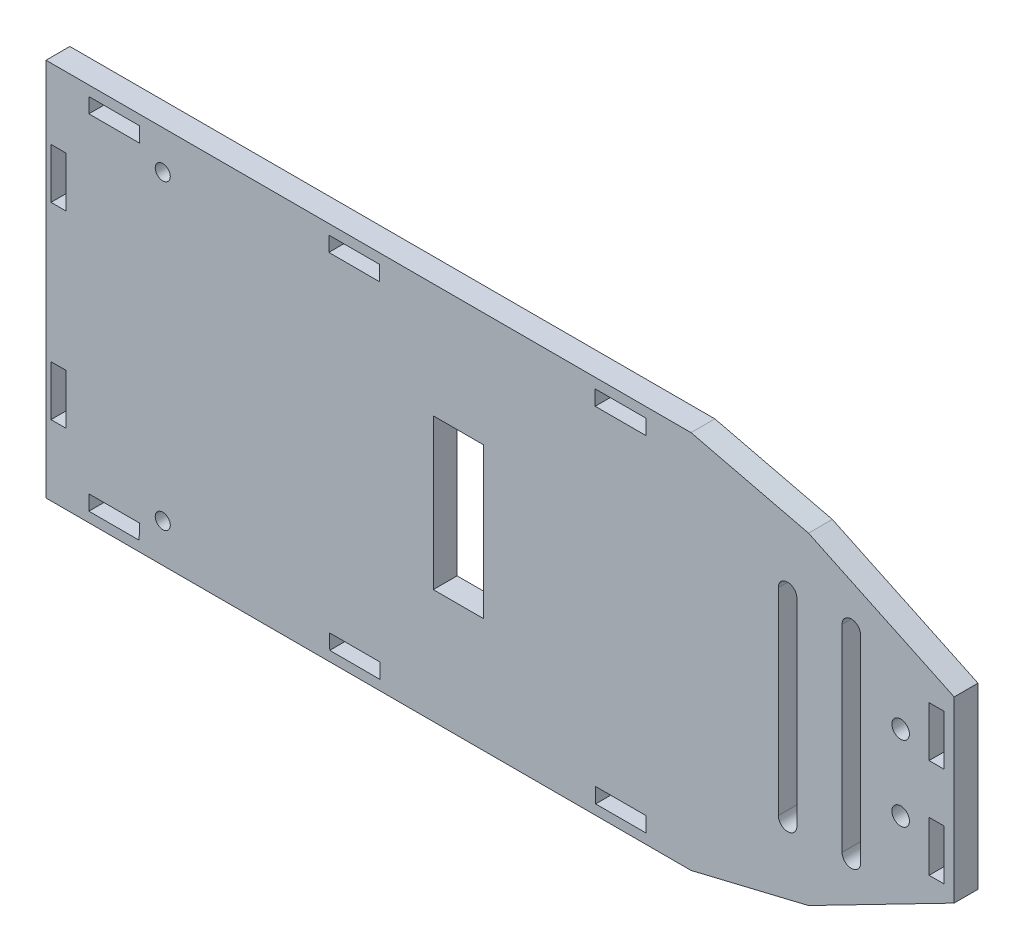
from build123d import *

# Parameters (mm, degrees)
SKETCH1_W           = 181
SKETCH1_H           = 75.57
BOSS_EXTRUDE2_DEPTH = 4.75
SKETCH6_W           = 3
SKETCH6_H           = 10
SKETCH6_W_2         = 10.095812656
SKETCH6_H_2         = 3.003442242
SKETCH6_W_3         = 10
SKETCH6_H_3         = 30
SKETCH6_R           = 1.5
SKETCH6_R_2         = 1.85
SKETCH6_R_3         = 1.75
CUT_EXTRUDE7_DEPTH  = 9
CUT_EXTRUDE8_DEPTH  = 4.75


with BuildPart() as part:
    # Sketch1 → Boss-Extrude2 (new body)
    with BuildSketch(Plane.XY):
        Rectangle(SKETCH1_W, SKETCH1_H)
    extrude(amount=BOSS_EXTRUDE2_DEPTH)

    # Sketch6 → Cut-Extrude7 (cut)
    with BuildSketch(Plane.XY.offset(4.75)):
        Polygon((-81.955185068, 35.785), (-81.955183992, 32.802018857), (-71.81277502, 32.798644215), (-71.859372412, 35.785), align=None)
        with Locations((-88, 18.75)):
            Rectangle(SKETCH6_W, SKETCH6_H)
        with Locations((-88, -18.75)):
            Rectangle(SKETCH6_W, SKETCH6_H)
        Polygon((-34.13878131, 35.785), (-34.130786214, 32.798291399), (-24.042968654, 32.781557758), (-24.042968654, 35.785), align=None)
        Polygon((-71.81277502, -32.788413815), (-81.955183992, -32.785039173), (-81.955181828, -35.785039173), (-71.955181828, -35.785031959), align=None)
        Polygon((-33.95518398, -32.801010013), (-33.947153334, -35.800999264), (-23.947156396, -35.808824865), (-23.946905936, -32.804340026), align=None)
        with Locations((87, 9.9)):
            Rectangle(SKETCH6_W, SKETCH6_H)
        with Locations((24.004937674, 34.283278879)):
            Rectangle(SKETCH6_W_2, SKETCH6_H_2)
        Polygon((29.052844002, -32.806257253), (19.053094123, -32.805423656), (19.052844037, -35.805423646), (29.052844002, -35.806257264), align=None)
        with Locations((-8.31156853, 0)):
            Rectangle(SKETCH6_W_3, SKETCH6_H_3)
        with Locations((87, -9.9)):
            Rectangle(SKETCH6_W, SKETCH6_H)
        Polygon((61.466273892, -32.14), (38.055212144, -37.785), (90.5, -37.785), (90.5, -17.2), align=None)
        Polygon((61.46627389, 32.14), (90.5, 18.385572572), (90.5, 37.785), (38.055212144, 37.785), align=None)
        with Locations((-67.23, 30.095)):
            Circle(SKETCH6_R)
        with Locations((-67.23, -30.095)):
            Circle(SKETCH6_R)
        with Locations((70.00651733, -12.753407437)):
            Circle(SKETCH6_R_2)
        with Locations((70.00651733, 12.892480558)):
            Circle(SKETCH6_R_2)
        with Locations((70.00651733, 0)):
            Circle(SKETCH6_R_2)
        with Locations((57.30651733, 12.892480558)):
            Circle(SKETCH6_R_2)
        with Locations((57.30651733, 0)):
            Circle(SKETCH6_R_2)
        with Locations((57.30651733, -12.753407437)):
            Circle(SKETCH6_R_2)
        with Locations((79.833359723, -7.5)):
            Circle(SKETCH6_R_3)
        with Locations((79.833359723, 7.5)):
            Circle(SKETCH6_R_3)
    extrude(amount=-CUT_EXTRUDE7_DEPTH, mode=Mode.SUBTRACT)

    # Sketch9 → Cut-Extrude8 (cut)
    with BuildSketch(Plane.XY.offset(4.75)):
        with BuildLine():
            Line((59.15651733, 19.742480558), (59.15651733, -19.603407437))
            ThreePointArc((59.15651733, -19.603407437), (57.30651733, -21.453407437), (55.45651733, -19.603407437))
            Line((55.45651733, -19.603407437), (55.45651733, 19.742480558))
            ThreePointArc((55.45651733, 19.742480558), (57.30651733, 21.592480558), (59.15651733, 19.742480558))
        make_face()
        with BuildLine():
            Line((71.85651733, 19.742480558), (71.85651733, -19.603407437))
            ThreePointArc((71.85651733, -19.603407437), (70.00651733, -21.453407437), (68.15651733, -19.603407437))
            Line((68.15651733, -19.603407437), (68.15651733, 19.742480558))
            ThreePointArc((68.15651733, 19.742480558), (70.00651733, 21.592480558), (71.85651733, 19.742480558))
        make_face()
    extrude(amount=-CUT_EXTRUDE8_DEPTH, mode=Mode.SUBTRACT)


solid = part.part
